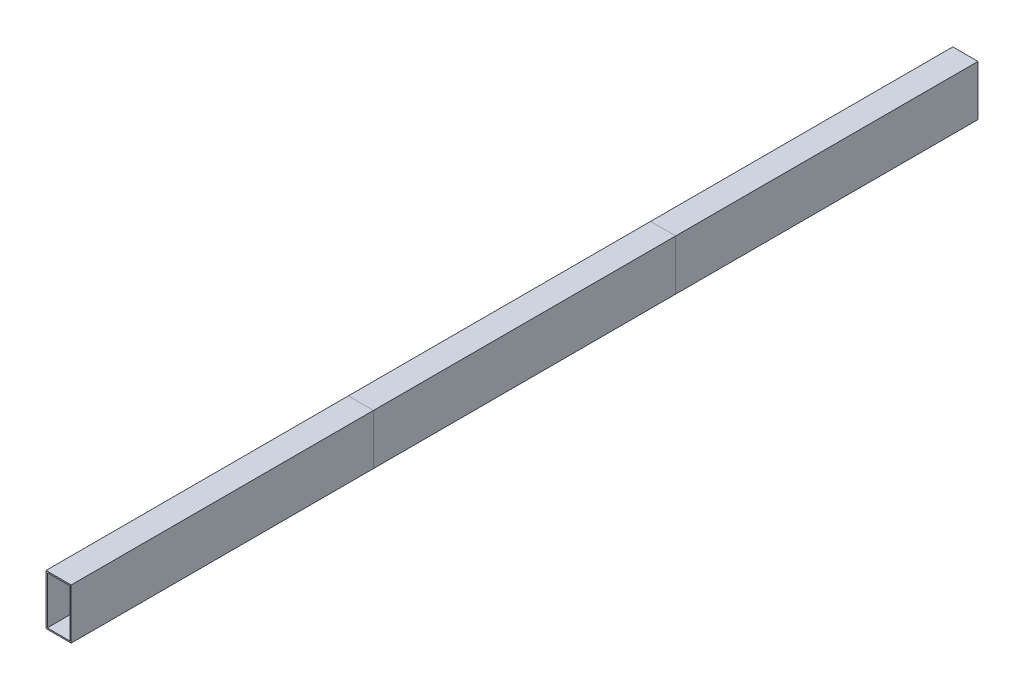
from build123d import *

# Parameters (mm, degrees)
SKETCH_2_W      = 100
SKETCH_2_H      = 200
SKETCH_2_W_2    = 90
SKETCH_2_H_2    = 190
EXTRUDE_1_DEPTH = 1200
EXTRUDE_START   = 1200
SKETCH_2_2_W    = 100
SKETCH_2_2_H    = 200
SKETCH_2_2_W_2  = 90
SKETCH_2_2_H_2  = 190
EXTRUDE_2_DEPTH = 1200
EXTRUDE_START_2 = 2400
SKETCH_2_3_W    = 100
SKETCH_2_3_H    = 200
SKETCH_2_3_W_2  = 90
SKETCH_2_3_H_2  = 190
EXTRUDE_3_DEPTH = 1200


with BuildPart() as part:
    # Эскиз2 → Бобышка-Вытянуть1 (new body)
    with BuildSketch(Plane.XY):
        Rectangle(SKETCH_2_W, SKETCH_2_H)
        Rectangle(SKETCH_2_W_2, SKETCH_2_H_2, mode=Mode.SUBTRACT)
    extrude(amount=EXTRUDE_1_DEPTH)


with BuildPart() as body_2:
    # Эскиз2<2> → Бобышка-Вытянуть2 (new body)
    with BuildSketch(Plane.XY.offset(EXTRUDE_START)):
        Rectangle(SKETCH_2_2_W, SKETCH_2_2_H)
        Rectangle(SKETCH_2_2_W_2, SKETCH_2_2_H_2, mode=Mode.SUBTRACT)
    extrude(amount=EXTRUDE_2_DEPTH)


with BuildPart() as body_3:
    # Эскиз2<3> → Бобышка-Вытянуть3 (new body)
    with BuildSketch(Plane.XY.offset(EXTRUDE_START_2)):
        Rectangle(SKETCH_2_3_W, SKETCH_2_3_H)
        Rectangle(SKETCH_2_3_W_2, SKETCH_2_3_H_2, mode=Mode.SUBTRACT)
    extrude(amount=EXTRUDE_3_DEPTH)


solid = Compound([part.part, body_2.part, body_3.part])
